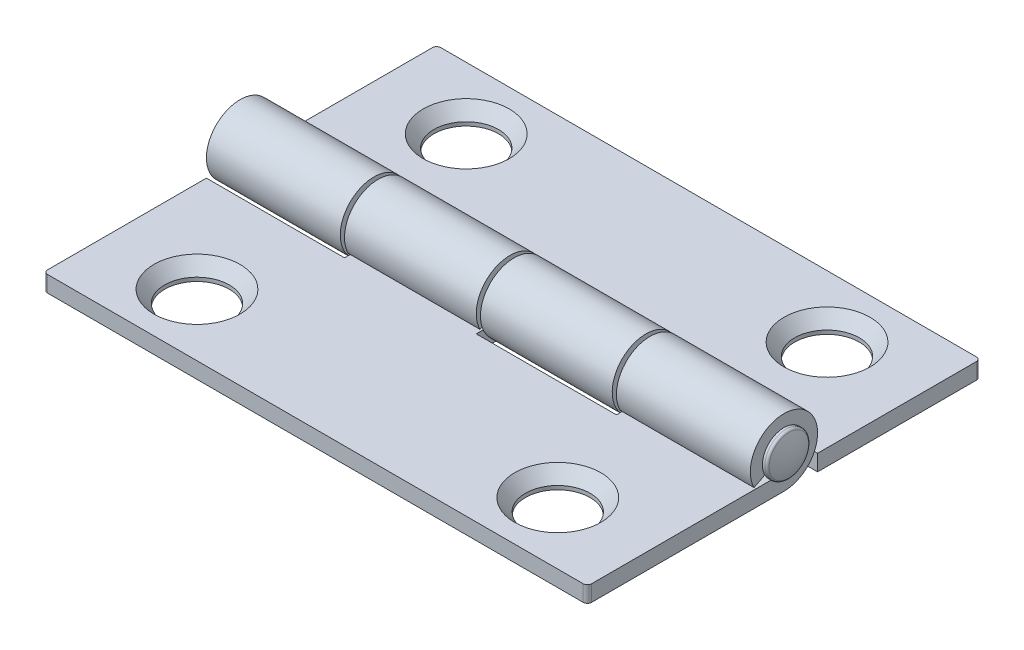
from build123d import *

# Parameters (mm, degrees)
BOSS_EXTRUDE1_DEPTH     = 25.654
SKETCH4_W               = 12.827
SKETCH4_H               = 6.35
CUT_EXTRUDE1_DEPTH      = 32.812169134
LPATTERN1_COUNT         = 2
LPATTERN1_PITCH         = 25.654
CUT_EXTRUDE2_DEPTH      = 33.019115478
CUT_EXTRUDE2_DEPTH_BACK = 33.019115478
SKETCH5_W               = 0.1984375
SKETCH5_H               = 6.35
SKETCH6_R               = 3.048
CUT_EXTRUDE3_DEPTH      = 33.019115478
FILLET1_R               = 0.396875
CIRPATTERN1_COUNT       = 2
SKETCH8_R               = 1.651
BOSS_EXTRUDE2_DEPTH     = 25.654


with BuildPart() as part:
    # Sketch3 → Boss-Extrude1 (new, symmetric)
    with BuildSketch(Plane(origin=(0, 0, 0), x_dir=(0, 0, -1), z_dir=(1, 0, 0))):
        with BuildLine():
            Line((0, -3.175), (-18.542, -3.175))
            Line((-18.542, -3.175), (-18.542, -1.651))
            Line((-18.542, -1.651), (0, -1.651))
            ThreePointArc((0, -1.651), (0.856809561, 1.411268357), (-1.464794939, -0.761693368))
            Line((-1.464794939, -0.761693368), (-2.816913344, -1.464794939))
            ThreePointArc((-2.816913344, -1.464794939), (1.647710695, 2.71397761), (0, -3.175))
        make_face()
    extrude(amount=BOSS_EXTRUDE1_DEPTH, both=True)

    # Sketch4 → Cut-Extrude1 (cut, symmetric)
    with BuildSketch(Plane(origin=(0, 0, 0), x_dir=(1, 0, 0), z_dir=(0, 1, 0))):
        with Locations((6.4135, 0)):
            Rectangle(SKETCH4_W, SKETCH4_H)
    cut_extrude1 = extrude(amount=CUT_EXTRUDE1_DEPTH, both=True, mode=Mode.SUBTRACT)

    # LPattern1: Cut-Extrude1 ×2
    with Locations(*[(-i * LPATTERN1_PITCH, 0, 0) for i in range(1, LPATTERN1_COUNT)]):
        add(cut_extrude1, mode=Mode.SUBTRACT)

    # Sketch5 → Cut-Extrude2 (cut, two sides: drawn at the far end of the back side and taken through both)
    with BuildSketch(Plane(origin=(0, -1.651, 0), x_dir=(1, 0, 0), z_dir=(0, 1, 0)).offset(-CUT_EXTRUDE2_DEPTH_BACK)):
        with Locations((-12.72778125, 0)):
            Rectangle(SKETCH5_W, SKETCH5_H)
        with Locations((-0.09921875, 0)):
            Rectangle(SKETCH5_W, SKETCH5_H)
        with Locations((12.92621875, 0)):
            Rectangle(SKETCH5_W, SKETCH5_H)
    extrude(amount=CUT_EXTRUDE2_DEPTH + CUT_EXTRUDE2_DEPTH_BACK, mode=Mode.SUBTRACT)

    # Sketch6 → Cut-Extrude3 (cut, through all)
    with BuildSketch(Plane(origin=(0, -1.651, 0), x_dir=(1, 0, 0), z_dir=(0, 1, 0))):
        with Locations(Location((17.018, -12.7, 0), (0, 0, 270))):
            Circle(SKETCH6_R)
        with Locations(Location((-17.018, -12.7, 0), (0, 0, 270))):
            Circle(SKETCH6_R)
    extrude(amount=-CUT_EXTRUDE3_DEPTH, mode=Mode.SUBTRACT)

    # Cut-Extrude4 cone 1 section (through the dimple's axis) → Cut-Extrude4 (revolve, cut)
    with BuildSketch(Plane(origin=(-17.018, -1.651, 12.7), x_dir=(0, 0, 1), z_dir=(1, 0, 0))):
        Polygon((0, 0), (4.064, 0), (0, 4.675097207), align=None)
    revolve(axis=Axis((-17.018, -1.651, 12.7), (0, -1, 0)), mode=Mode.SUBTRACT)

    # Cut-Extrude4 cone 2 section (through the dimple's axis) → Cut-Extrude4 cone 2 (revolve, cut)
    with BuildSketch(Plane(origin=(17.018, -1.651, 12.7), x_dir=(0, 0, 1), z_dir=(1, 0, 0))):
        Polygon((0, 0), (4.064, 0), (0, 4.675097207), align=None)
    revolve(axis=Axis((17.018, -1.651, 12.7), (0, -1, 0)), mode=Mode.SUBTRACT)

    # Fillet1
    fillet1_edges = [part.edges().sort_by_distance(p)[0] for p in [
        (25.654, -2.413, 18.542),
        (-25.654, -2.413, 18.542),
    ]]
    fillet(fillet1_edges, radius=FILLET1_R)


with BuildPart() as cirpattern1_1:
    # CirPattern1: pattern copy
    add(part.part.rotate(Axis((0, 0, 0), (0, 1, 0)), 1 * 360 / CIRPATTERN1_COUNT))


with BuildPart() as body_3:
    # Sketch8 → Boss-Extrude2 (new, symmetric)
    with BuildSketch(Plane(origin=(0, 0, 0), x_dir=(0, 0, -1), z_dir=(1, 0, 0))):
        Circle(SKETCH8_R)
    extrude(amount=BOSS_EXTRUDE2_DEPTH, both=True)

    # Sketch9 → Revolve1 (revolve)
    with BuildSketch(Plane.XY):
        with BuildLine():
            Line((25.654, 2.032), (25.654, 0))
            Line((25.654, 0), (26.44775, 0))
            ThreePointArc((26.44775, 0), (26.363966303, 0.947578032), (26.115214931, 1.865753717))
            ThreePointArc((26.115214931, 1.865753717), (26.022159448, 1.9863332), (25.87685536, 2.032))
            Line((25.87685536, 2.032), (25.654, 2.032))
        make_face()
    revolve(axis=Axis((25.654, 0, 0), (-1, 0, 0)))


solid = Compound([part.part, cirpattern1_1.part, body_3.part])
